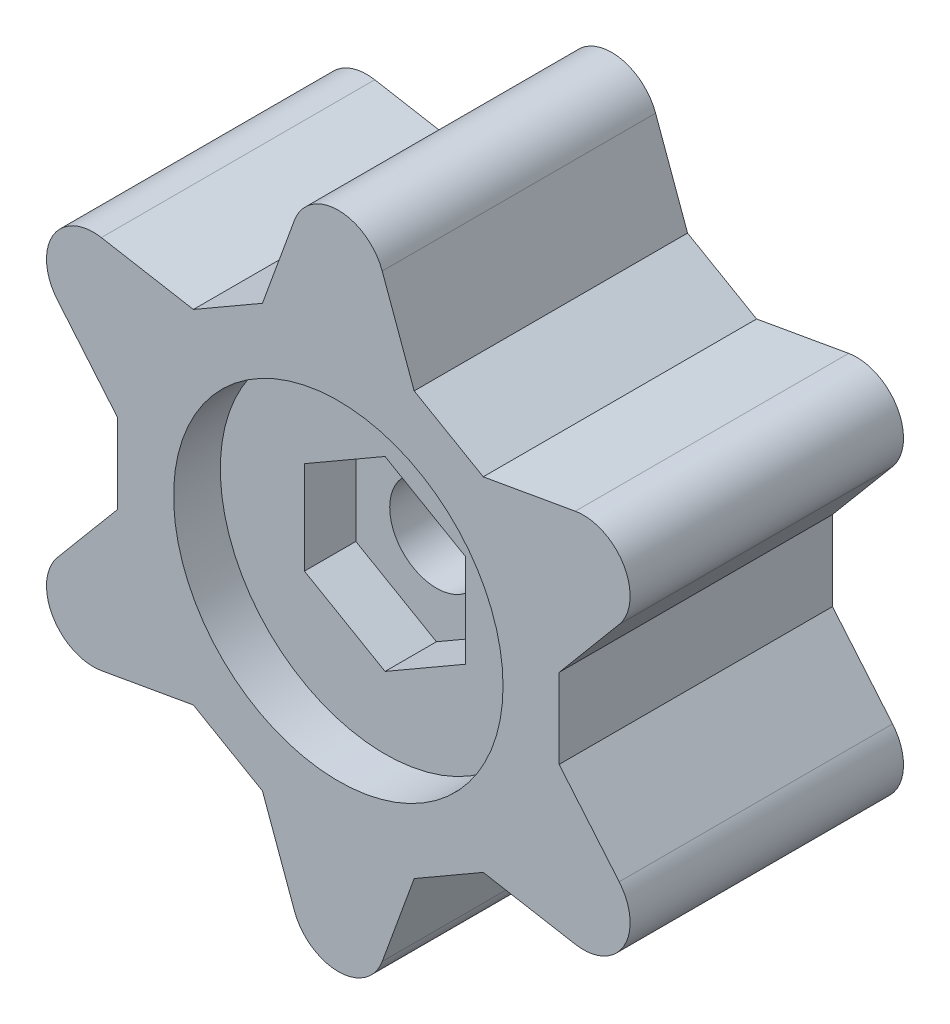
from build123d import *

# Parameters (mm, degrees)
BOSS_EXTRUDE1_DEPTH = 9.7
SKETCH5_R           = 2
BOSS_EXTRUDE2_DEPTH = 7.5
SKETCH6_R           = 7.05
BOSS_EXTRUDE3_DEPTH = 2


with BuildPart() as part:
    # Sketch1 → Boss-Extrude1 (new body)
    with BuildSketch(Plane.XY):
        with BuildLine():
            Line((-3.247465815, 9.036994825), (-1.879385242, 12.795765308))
            ThreePointArc((-1.879385242, 12.795765308), (0, 14.111725022), (1.879385242, 12.795765308))
            Line((1.879385242, 12.795765308), (3.247465815, 9.036994825))
            Line((3.247465815, 9.036994825), (6.202534185, 7.330885306))
            Line((6.202534185, 7.330885306), (10.141765197, 8.025478017))
            ThreePointArc((10.141765197, 8.025478017), (12.22111236, 7.055862511), (12.021150439, 4.770287292))
            Line((12.021150439, 4.770287292), (9.45, 1.706109519))
            Line((9.45, 1.706109519), (9.45, -1.706109519))
            Line((9.45, -1.706109519), (12.021150439, -4.770287292))
            ThreePointArc((12.021150439, -4.770287292), (12.22111236, -7.055862511), (10.141765197, -8.025478017))
            Line((10.141765197, -8.025478017), (6.202534185, -7.330885306))
            Line((6.202534185, -7.330885306), (3.247465815, -9.036994825))
            Line((3.247465815, -9.036994825), (1.879385242, -12.795765308))
            ThreePointArc((1.879385242, -12.795765308), (0, -14.111725022), (-1.879385242, -12.795765308))
            Line((-1.879385242, -12.795765308), (-3.247465815, -9.036994825))
            Line((-3.247465815, -9.036994825), (-6.202534185, -7.330885306))
            Line((-6.202534185, -7.330885306), (-10.141765197, -8.025478017))
            ThreePointArc((-10.141765197, -8.025478017), (-12.22111236, -7.055862511), (-12.021150439, -4.770287292))
            Line((-12.021150439, -4.770287292), (-9.45, -1.706109519))
            Line((-9.45, -1.706109519), (-9.45, 1.706109519))
            Line((-9.45, 1.706109519), (-12.021150439, 4.770287292))
            ThreePointArc((-12.021150439, 4.770287292), (-12.22111236, 7.055862511), (-10.141765197, 8.025478017))
            Line((-10.141765197, 8.025478017), (-6.202534185, 7.330885306))
            Line((-6.202534185, 7.330885306), (-3.247465815, 9.036994825))
        make_face()
        Polygon((3.45, -1.991858429), (3.45, 1.991858429), (0, 3.983716857), (-3.45, 1.991858429), (-3.45, -1.991858429), (0, -3.983716857), align=None, mode=Mode.SUBTRACT)
    extrude(amount=BOSS_EXTRUDE1_DEPTH)

    # Sketch5 → Boss-Extrude2 (add)
    with BuildSketch(Plane(origin=(0, 0, 0), x_dir=(-1, 0, 0), z_dir=(0, 0, -1))):
        Polygon((-3.45, 1.991858429), (0, 3.983716857), (3.45, 1.991858429), (3.45, -1.991858429), (0, -3.983716857), (-3.45, -1.991858429), align=None)
        Circle(SKETCH5_R, mode=Mode.SUBTRACT)
    extrude(amount=-BOSS_EXTRUDE2_DEPTH)

    # Sketch6 → Boss-Extrude3 (add)
    with BuildSketch(Plane.XY.offset(9.7)):
        with BuildLine():
            Line((-3.247465815, 9.036994825), (-6.202534185, 7.330885306))
            Line((-6.202534185, 7.330885306), (-10.141765197, 8.025478017))
            ThreePointArc((-10.141765197, 8.025478017), (-12.22111236, 7.055862511), (-12.021150439, 4.770287292))
            Line((-12.021150439, 4.770287292), (-9.45, 1.706109519))
            Line((-9.45, 1.706109519), (-9.45, -1.706109519))
            Line((-9.45, -1.706109519), (-12.021150439, -4.770287292))
            ThreePointArc((-12.021150439, -4.770287292), (-12.22111236, -7.055862511), (-10.141765197, -8.025478017))
            Line((-10.141765197, -8.025478017), (-6.202534185, -7.330885306))
            Line((-6.202534185, -7.330885306), (-3.247465815, -9.036994825))
            Line((-3.247465815, -9.036994825), (-1.879385242, -12.795765308))
            ThreePointArc((-1.879385242, -12.795765308), (0, -14.111725022), (1.879385242, -12.795765308))
            Line((1.879385242, -12.795765308), (3.247465815, -9.036994825))
            Line((3.247465815, -9.036994825), (6.202534185, -7.330885306))
            Line((6.202534185, -7.330885306), (10.141765197, -8.025478017))
            ThreePointArc((10.141765197, -8.025478017), (12.22111236, -7.055862511), (12.021150439, -4.770287292))
            Line((12.021150439, -4.770287292), (9.45, -1.706109519))
            Line((9.45, -1.706109519), (9.45, 1.706109519))
            Line((9.45, 1.706109519), (12.021150439, 4.770287292))
            ThreePointArc((12.021150439, 4.770287292), (12.22111236, 7.055862511), (10.141765197, 8.025478017))
            Line((10.141765197, 8.025478017), (6.202534185, 7.330885306))
            Line((6.202534185, 7.330885306), (3.247465815, 9.036994825))
            Line((3.247465815, 9.036994825), (1.879385242, 12.795765308))
            ThreePointArc((1.879385242, 12.795765308), (0, 14.111725022), (-1.879385242, 12.795765308))
            Line((-1.879385242, 12.795765308), (-3.247465815, 9.036994825))
        make_face()
        Circle(SKETCH6_R, mode=Mode.SUBTRACT)
    extrude(amount=BOSS_EXTRUDE3_DEPTH)


solid = part.part
